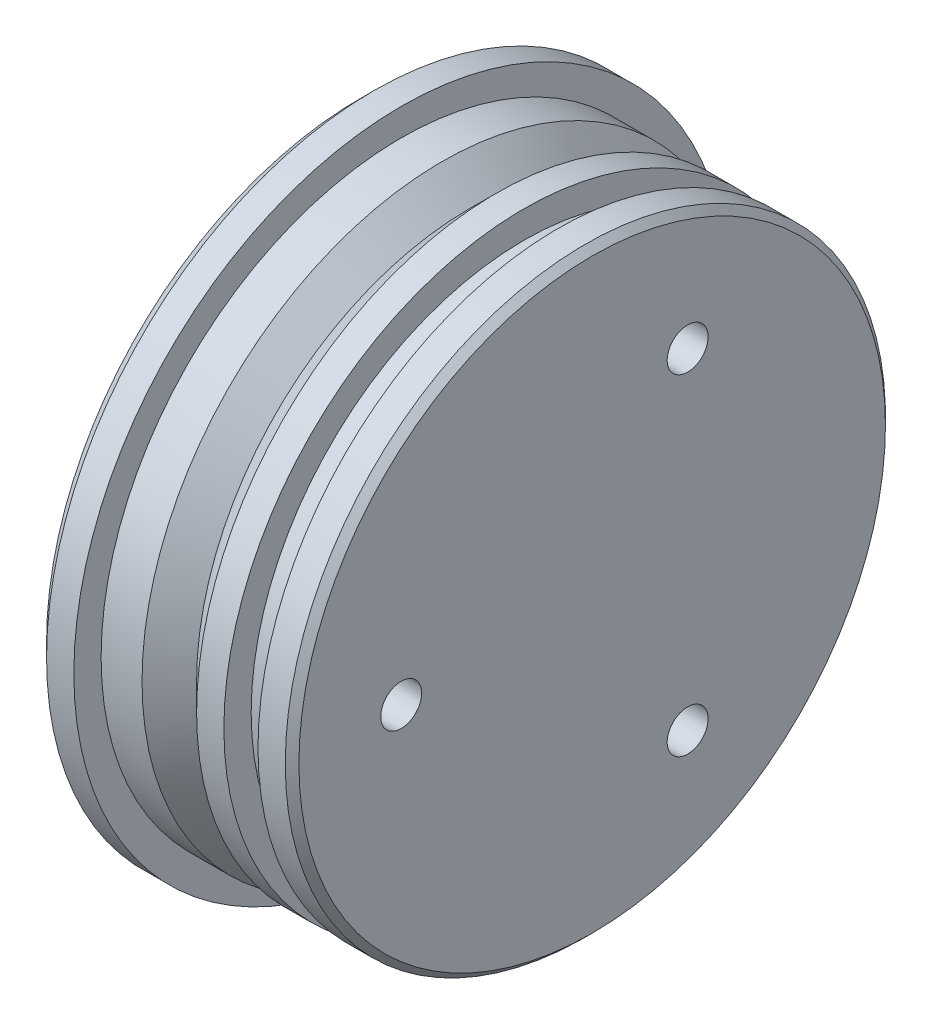
from build123d import *

# Parameters (mm, degrees)
SKETCH_2_R          = 1.5
CUT_EXTRUDE_1_DEPTH = 10


with BuildPart() as part:
    # Эскиз1 → Повернуть1 (revolve)
    with BuildSketch(Plane.XY, mode=Mode.PRIVATE) as revolve_1_sk:
        Polygon((-17, 0), (-17, 23), (-16, 24), (-14, 24), (-14, 22), (-11, 22), (-9, 20), (-7, 22), (-5, 22), (-5, 20), (-2.5, 20), (-2.5, 22), (-0.5, 22), (0, 21.5), (0, 0), align=None)
    revolve(revolve_1_sk.sketch.rotate(Axis((0, 0, 0), (1, 0, 0)), 90), axis=Axis((0, 0, 0), (1, 0, 0)))

    # Эскиз2 → Вырез-Вытянуть1 (cut)
    with BuildSketch(Plane(origin=(0, 0, 0), x_dir=(0, 0, -1), z_dir=(1, 0, 0))):
        with Locations((7, 12.124355653)):
            Circle(SKETCH_2_R)
        with Locations((7, -12.124355653)):
            Circle(SKETCH_2_R)
        with Locations((-14, 0)):
            Circle(SKETCH_2_R)
    extrude(amount=-CUT_EXTRUDE_1_DEPTH, mode=Mode.SUBTRACT)


solid = part.part
